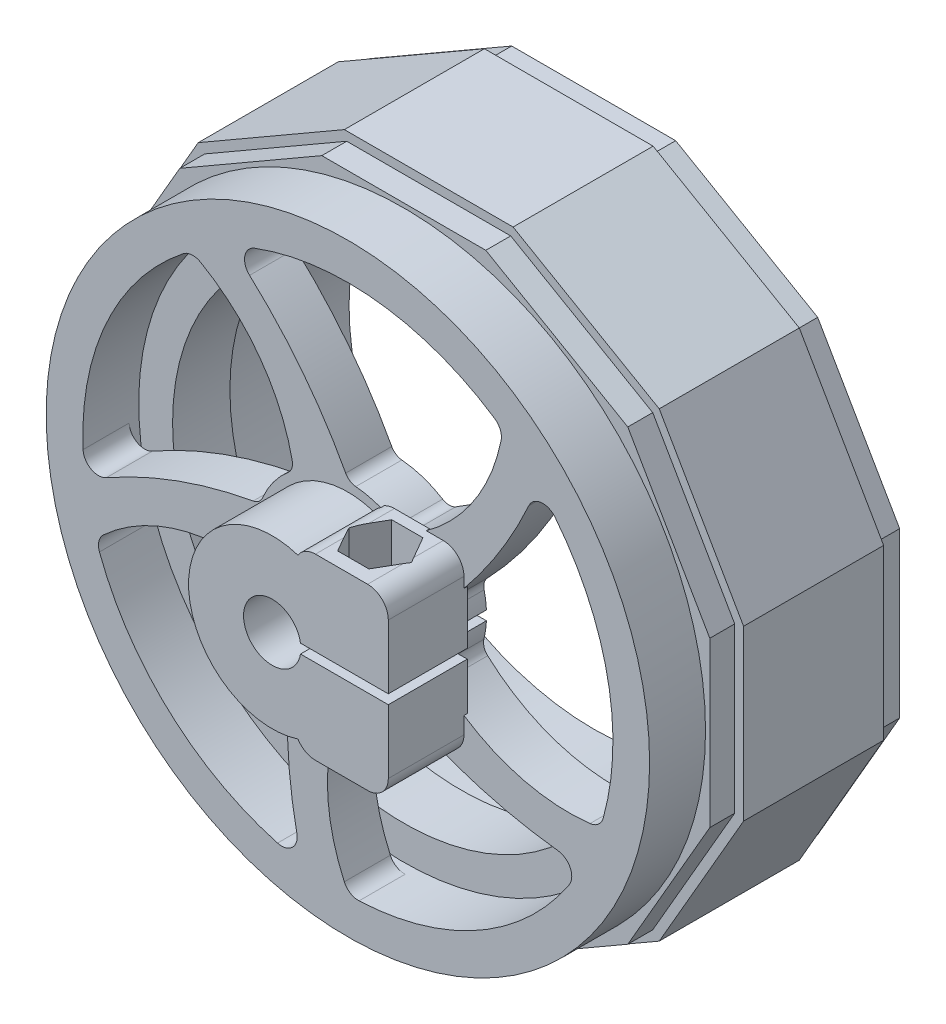
from build123d import *

# Parameters (mm, degrees)
S01_SMALLER_TWELVE_FLAT_END_BEAD_SEATS_R      = 24.6
F_01_SMALLER_TWELVE_FLAT_END_BEAD_SEATS_DEPTH = 20.2
F_02_START                                    = 2.65
S02_RAISED_CENTRAL_TYRE_DRIVE_KEY_R           = 24.6
F_02_RAISED_CENTRAL_TYRE_DRIVE_KEY_DEPTH      = 14.9
PAIR_START                                    = 14.1
PAIR_OF_6808_BEARING_SEATS_LAYOUT_R           = 26.025
PAIR_OF_6808_BEARING_SEATS_DEPTH              = 14.22
RIM_START                                     = 19.9
RIM_CROWN_FOR_SPOKE_TIPS_LAYOUT_R             = 32.1
RIM_CROWN_FOR_SPOKE_TIPS_LAYOUT_R_2           = 28.2
RIM_CROWN_FOR_SPOKE_TIPS_DEPTH                = 6.25
FIVE_START                                    = 21.25
FIVE_SWEPT_LOAD_BEARING_SPOKES_DEPTH          = 4.9
SPOKE_START                                   = 21.25
SPOKE_ROOT_HUB_LAYOUT_R                       = 9.85
SPOKE_ROOT_HUB_DEPTH                          = 4.9
BLENDED_SPOKE_TIPS_TO_RIM_R                   = 1.65
BLENDED_SPOKE_ROOTS_TO_HUB_R                  = 1.35
MOTOR_START                                   = 25.8
MOTOR_SHAFT_CLAMP_BARREL_LAYOUT_R             = 8.9
MOTOR_SHAFT_CLAMP_BARREL_DEPTH                = 8.4
ROUNDED_START                                 = 25.8
ROUNDED_CLAMP_JAWS_DEPTH                      = 8.4
JOHNSON_START                                 = 34.35
JOHNSON_SHAFT_6_10_MM_BORE_LAYOUT_R           = 3.05
JOHNSON_SHAFT_6_10_MM_BORE_DEPTH              = 13.2
OPEN_START                                    = 34.32
CLAMP_SPLIT_LAYOUT_W                          = 13.5
CLAMP_SPLIT_LAYOUT_H                          = 1
OPEN_PINCH_SLOT_DEPTH                         = 13.16
M3_START                                      = 14
M3_PINCH_BOLT_CLEARANCE_LAYOUT_R              = 1.65
M3_PINCH_BOLT_CLEARANCE_DEPTH                 = 28
M3_START_2                                    = -7.5
M3_SCREW_HEAD_SEAT_LAYOUT_R                   = 3
M3_SCREW_HEAD_SEAT_DEPTH                      = 6.5
CAPTURED_START                                = 14
CAPTURED_M3_NUT_SEAT_DEPTH                    = 9


with BuildPart() as part:
    # S01 - Smaller twelve-flat end bead seats → 01 - Smaller twelve-flat end bead seats (new body)
    with BuildSketch(Plane.XY):
        Polygon((32.551700346, 8.72220182), (23.829498526, 23.829498526), (8.72220182, 32.551700346), (-8.72220182, 32.551700346), (-23.829498526, 23.829498526), (-32.551700346, 8.72220182), (-32.551700346, -8.72220182), (-23.829498526, -23.829498526), (-8.72220182, -32.551700346), (8.72220182, -32.551700346), (23.829498526, -23.829498526), (32.551700346, -8.72220182), align=None)
        Circle(S01_SMALLER_TWELVE_FLAT_END_BEAD_SEATS_R, mode=Mode.SUBTRACT)
    extrude(amount=F_01_SMALLER_TWELVE_FLAT_END_BEAD_SEATS_DEPTH)

    # S02 - Raised central tyre drive key → 02 - Raised central tyre drive key (add)
    with BuildSketch(Plane.XY.offset(F_02_START)):
        Polygon((33.498307656, 8.975844484), (24.522463172, 24.522463172), (8.975844484, 33.498307656), (-8.975844484, 33.498307656), (-24.522463172, 24.522463172), (-33.498307656, 8.975844484), (-33.498307656, -8.975844484), (-24.522463172, -24.522463172), (-8.975844484, -33.498307656), (8.975844484, -33.498307656), (24.522463172, -24.522463172), (33.498307656, -8.975844484), align=None)
        Circle(S02_RAISED_CENTRAL_TYRE_DRIVE_KEY_R, mode=Mode.SUBTRACT)
    extrude(amount=F_02_RAISED_CENTRAL_TYRE_DRIVE_KEY_DEPTH)

    # Pair of 6808 bearing seats layout → Pair of 6808 bearing seats (cut)
    with BuildSketch(Plane.XY.offset(PAIR_START)):
        Circle(PAIR_OF_6808_BEARING_SEATS_LAYOUT_R)
    extrude(amount=-PAIR_OF_6808_BEARING_SEATS_DEPTH, mode=Mode.SUBTRACT)

    # Rim crown for spoke tips layout → Rim crown for spoke tips (add)
    with BuildSketch(Plane.XY.offset(RIM_START)):
        Circle(RIM_CROWN_FOR_SPOKE_TIPS_LAYOUT_R)
        Circle(RIM_CROWN_FOR_SPOKE_TIPS_LAYOUT_R_2, mode=Mode.SUBTRACT)
    extrude(amount=RIM_CROWN_FOR_SPOKE_TIPS_DEPTH)

    # Five swept load-bearing spokes layout → Five swept load-bearing spokes (add)
    with BuildSketch(Plane.XY.offset(FIVE_START)):
        with BuildLine():
            Line((16.707925328, 26.095550027), (21.278387699, 22.52471347))
            ThreePointArc((21.278387699, 22.52471347), (15.951925441, 11.157973019), (7.933683179, 1.499723711))
            Line((7.933683179, 1.499723711), (3.877964939, 7.081940972))
            ThreePointArc((3.877964939, 7.081940972), (13.2712402, 14.579058248), (16.707925328, 26.095550027))
        make_face()
        with BuildLine():
            Line((-19.655310032, 23.954149693), (-14.846892112, 27.197468533))
            ThreePointArc((-14.846892112, 27.197468533), (-5.682446894, 18.619185924), (1.025320922, 8.0088212))
            Line((1.025320922, 8.0088212), (-5.53696904, 5.876603938))
            ThreePointArc((-5.53696904, 5.876603938), (-9.76446959, 17.126876232), (-19.655310032, 23.954149693))
        make_face()
        with BuildLine():
            Line((-28.855574988, -11.291071345), (-30.454271652, -5.715753509))
            ThreePointArc((-30.454271652, -5.715753509), (-19.463870761, 0.349316725), (-7.3, 3.45))
            Line((-7.3, 3.45), (-7.3, -3.45))
            ThreePointArc((-7.3, -3.45), (-19.306014289, -3.994066615), (-28.855574988, -11.291071345))
        make_face()
        with BuildLine():
            Line((1.821583925, -30.932415554), (-3.974882872, -30.729998473))
            ThreePointArc((-3.974882872, -30.729998473), (-6.346886789, -18.403296315), (-5.53696904, -5.876603938))
            Line((-5.53696904, -5.876603938), (1.025320922, -8.0088212))
            ThreePointArc((1.025320922, -8.0088212), (-2.167303428, -19.595345154), (1.821583925, -30.932415554))
        make_face()
        with BuildLine():
            Line((29.981375767, -7.826212821), (27.997658936, -13.276430022))
            ThreePointArc((27.997658936, -13.276430022), (15.541279003, -11.723179353), (3.877964939, -7.081940972))
            Line((3.877964939, -7.081940972), (7.933683179, -1.499723711))
            ThreePointArc((7.933683179, -1.499723711), (17.966547106, -8.116522711), (29.981375767, -7.826212821))
        make_face()
    extrude(amount=FIVE_SWEPT_LOAD_BEARING_SPOKES_DEPTH)

    # Spoke root hub layout → Spoke root hub (add)
    with BuildSketch(Plane.XY.offset(SPOKE_START)):
        Circle(SPOKE_ROOT_HUB_LAYOUT_R)
    extrude(amount=SPOKE_ROOT_HUB_DEPTH)

    # Blended spoke tips to rim
    blended_spoke_tips_to_rim_edges = [part.edges().sort_by_distance(p)[0] for p in [
        (20.247446723, 19.62857359, 23.7),
        (16.492445933, 22.87442299, 23.7),
        (24.924687949, -13.19090333, 23.7),
        (26.851315114, -8.616662734, 23.7),
        (-4.843142412, -27.78100019, 23.7),
        (0.10257945, -28.199813429, 23.7),
        (-27.917914572, -3.97869903, 23.7),
        (-26.787917527, -8.811780442, 23.7),
        (-12.411077689, 25.322028959, 23.7),
        (-16.658422969, 22.753833615, 23.7),
    ]]
    fillet(blended_spoke_tips_to_rim_edges, radius=BLENDED_SPOKE_TIPS_TO_RIM_R)

    # Blended spoke roots to hub
    blended_spoke_roots_to_hub_edges = [part.edges().sort_by_distance(p)[0] for p in [
        (-5.766955509, 7.985281721, 23.7),
        (-9.330144723, 3.157673107, 23.7),
        (-9.376541473, -3.01711286, 23.7),
        (-5.886298864, -7.897720284, 23.7),
        (-0.028065818, -9.849960016, 23.7),
        (5.692211957, -8.038732676, 23.7),
        (9.359195843, -3.070497218, 23.7),
        (9.404279325, 2.929510263, 23.7),
        (5.812366957, 7.952288373, 23.7),
        (0.119952306, 9.849269589, 23.7),
    ]]
    fillet(blended_spoke_roots_to_hub_edges, radius=BLENDED_SPOKE_ROOTS_TO_HUB_R)

    # Motor shaft clamp barrel layout → Motor shaft clamp barrel (add)
    with BuildSketch(Plane.XY.offset(MOTOR_START)):
        Circle(MOTOR_SHAFT_CLAMP_BARREL_LAYOUT_R)
    extrude(amount=MOTOR_SHAFT_CLAMP_BARREL_DEPTH)

    # Rounded clamp jaws layout → Rounded clamp jaws (add)
    with BuildSketch(Plane.XY.offset(ROUNDED_START)):
        with BuildLine():
            Line((4.6, -9.5), (10.15, -9.5))
            ThreePointArc((10.15, -9.5), (11.705634919, -8.855634919), (12.35, -7.3))
            Line((12.35, -7.3), (12.35, 7.3))
            ThreePointArc((12.35, 7.3), (11.705634919, 8.855634919), (10.15, 9.5))
            Line((10.15, 9.5), (4.6, 9.5))
            ThreePointArc((4.6, 9.5), (3.044365081, 8.855634919), (2.4, 7.3))
            Line((2.4, 7.3), (2.4, -7.3))
            ThreePointArc((2.4, -7.3), (3.044365081, -8.855634919), (4.6, -9.5))
        make_face()
    extrude(amount=ROUNDED_CLAMP_JAWS_DEPTH)

    # Johnson shaft - 6.10 mm bore layout → Johnson shaft - 6.10 mm bore (cut)
    with BuildSketch(Plane.XY.offset(JOHNSON_START)):
        Circle(JOHNSON_SHAFT_6_10_MM_BORE_LAYOUT_R)
    extrude(amount=-JOHNSON_SHAFT_6_10_MM_BORE_DEPTH, mode=Mode.SUBTRACT)

    # Clamp split layout → Open pinch slot (cut)
    with BuildSketch(Plane.XY.offset(OPEN_START)):
        with Locations((6.75, 0)):
            Rectangle(CLAMP_SPLIT_LAYOUT_W, CLAMP_SPLIT_LAYOUT_H)
    extrude(amount=-OPEN_PINCH_SLOT_DEPTH, mode=Mode.SUBTRACT)

    # M3 pinch bolt clearance layout → M3 pinch bolt clearance (cut)
    with BuildSketch(Plane(origin=(0, 0, 0), x_dir=(1, 0, 0), z_dir=(0, 1, 0)).offset(M3_START)):
        with Locations((7.15, -29.85)):
            Circle(M3_PINCH_BOLT_CLEARANCE_LAYOUT_R)
    extrude(amount=-M3_PINCH_BOLT_CLEARANCE_DEPTH, mode=Mode.SUBTRACT)

    # M3 screw head seat layout → M3 screw head seat (cut)
    with BuildSketch(Plane(origin=(0, 0, 0), x_dir=(1, 0, 0), z_dir=(0, 1, 0)).offset(M3_START_2)):
        with Locations((7.15, -29.85)):
            Circle(M3_SCREW_HEAD_SEAT_LAYOUT_R)
    extrude(amount=-M3_SCREW_HEAD_SEAT_DEPTH, mode=Mode.SUBTRACT)

    # Captured M3 nut seat layout → Captured M3 nut seat (cut)
    with BuildSketch(Plane(origin=(0, 0, 0), x_dir=(1, 0, 0), z_dir=(0, 1, 0)).offset(CAPTURED_START)):
        Polygon((10.469764048, -29.85), (8.809882024, -32.725), (5.490117976, -32.725), (3.830235952, -29.85), (5.490117976, -26.975), (8.809882024, -26.975), align=None)
    extrude(amount=-CAPTURED_M3_NUT_SEAT_DEPTH, mode=Mode.SUBTRACT)


solid = part.part
